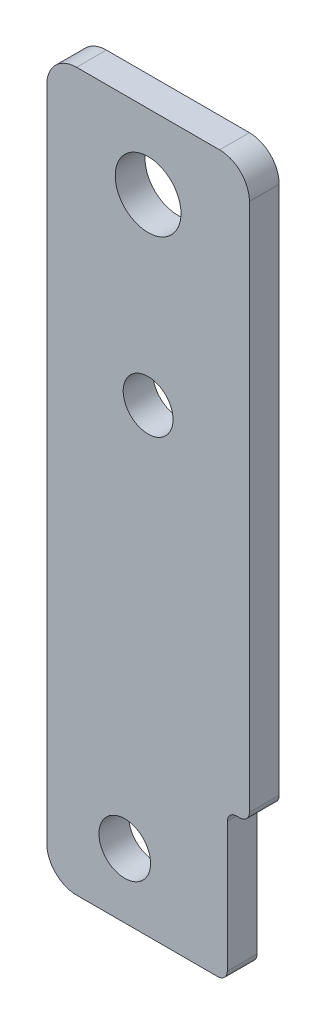
from build123d import *

# Parameters (mm, degrees)
SKETCH1_R           = 3.5052
SKETCH1_R_2         = 2.75082
SKETCH1_R_3         = 2.654
BOSS_EXTRUDE1_DEPTH = 3.175
FILLET1_R           = 3.175
SKETCH3_W           = 2.54
SKETCH3_H           = 15.868015335
CUT_EXTRUDE2_DEPTH  = 47.655831395
FILLET2_R           = 1


with BuildPart() as part:
    # Sketch1 → Boss-Extrude1 (new body)
    with BuildSketch(Plane.XY):
        Polygon((-10.795, 31.115), (10.795, 31.115), (10.795, -31.115), (10.795, -45.278625787), (-10.795, -45.278625787), (-10.795, -31.115), align=None)
        with Locations((0, 23.1775)):
            Circle(SKETCH1_R, mode=Mode.SUBTRACT)
        with Locations((-2.4892, -38.41242)):
            Circle(SKETCH1_R_2, mode=Mode.SUBTRACT)
        with Locations((0, 3.734436212)):
            Circle(SKETCH1_R_3, mode=Mode.SUBTRACT)
    extrude(amount=BOSS_EXTRUDE1_DEPTH)

    # Fillet1
    fillet1_edges = [part.edges().sort_by_distance(p)[0] for p in [
        (10.795, -45.278625787, 1.5875),
        (-10.795, -45.278625787, 1.5875),
        (-10.795, 31.115, 1.5875),
        (10.795, 31.115, 1.5875),
    ]]
    fillet(fillet1_edges, radius=FILLET1_R)

    # Sketch3 → Cut-Extrude2 (cut, through all)
    with BuildSketch(Plane.XY.offset(3.175)):
        with Locations((9.706042249, -37.379761593)):
            Rectangle(SKETCH3_W, SKETCH3_H)
    extrude(amount=-CUT_EXTRUDE2_DEPTH, mode=Mode.SUBTRACT)

    # Fillet2
    fillet2_edges = [part.edges().sort_by_distance(p)[0] for p in [
        (10.795, -29.445753925, 1.5875),
        (8.436042249, -29.445753925, 1.5875),
        (8.436042249, -45.171964108, 1.5875),
    ]]
    fillet(fillet2_edges, radius=FILLET2_R)


solid = part.part
